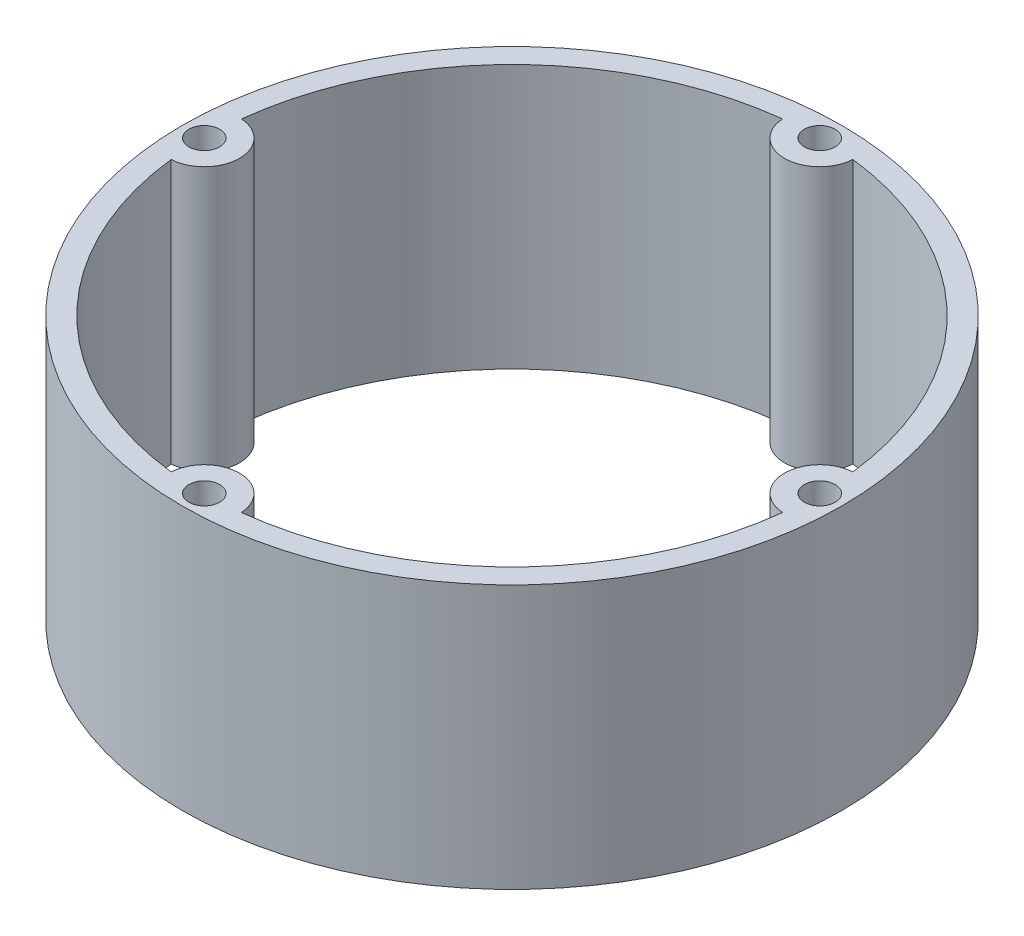
from build123d import *

# Parameters (mm, degrees)
IZIM1_R                     = 37.5
IZIM1_R_2                   = 1.75
Y_KSEKLIK_EKSTR_ZYON1_DEPTH = 30


with BuildPart() as part:
    # Çizim1 → Yükseklik-Ekstrüzyon1 (new body)
    with BuildSketch(Plane(origin=(0, 0, 0), x_dir=(1, 0, 0), z_dir=(0, 1, 0))):
        with Locations(Location((0, 0, 0), (0, 0, 270))):
            Circle(IZIM1_R)
        with Locations(Location((0, 35, 0), (0, 0, 270))):
            Circle(IZIM1_R_2, mode=Mode.SUBTRACT)
        with Locations(Location((35, 0, 0), (0, 0, 270))):
            Circle(IZIM1_R_2, mode=Mode.SUBTRACT)
        with Locations(Location((0, -35, 0), (0, 0, 270))):
            Circle(IZIM1_R_2, mode=Mode.SUBTRACT)
        with Locations(Location((-35, 0, 0), (0, 0, 270))):
            Circle(IZIM1_R_2, mode=Mode.SUBTRACT)
        with BuildLine():
            ThreePointArc((-34.771428571, -3.993464048), (-24.748737342, -24.748737342), (-3.993464048, -34.771428571))
            ThreePointArc((-3.993464048, -34.771428571), (0, -31), (3.993464048, -34.771428571))
            ThreePointArc((3.993464048, -34.771428571), (24.748737342, -24.748737342), (34.771428571, -3.993464048))
            ThreePointArc((34.771428571, -3.993464048), (31, 0), (34.771428571, 3.993464048))
            ThreePointArc((34.771428571, 3.993464048), (24.748737342, 24.748737342), (3.993464048, 34.771428571))
            ThreePointArc((3.993464048, 34.771428571), (0, 31), (-3.993464048, 34.771428571))
            ThreePointArc((-3.993464048, 34.771428571), (-24.748737342, 24.748737342), (-34.771428571, 3.993464048))
            ThreePointArc((-34.771428571, 3.993464048), (-31, 0), (-34.771428571, -3.993464048))
        make_face(mode=Mode.SUBTRACT)
    extrude(amount=Y_KSEKLIK_EKSTR_ZYON1_DEPTH)


solid = part.part
